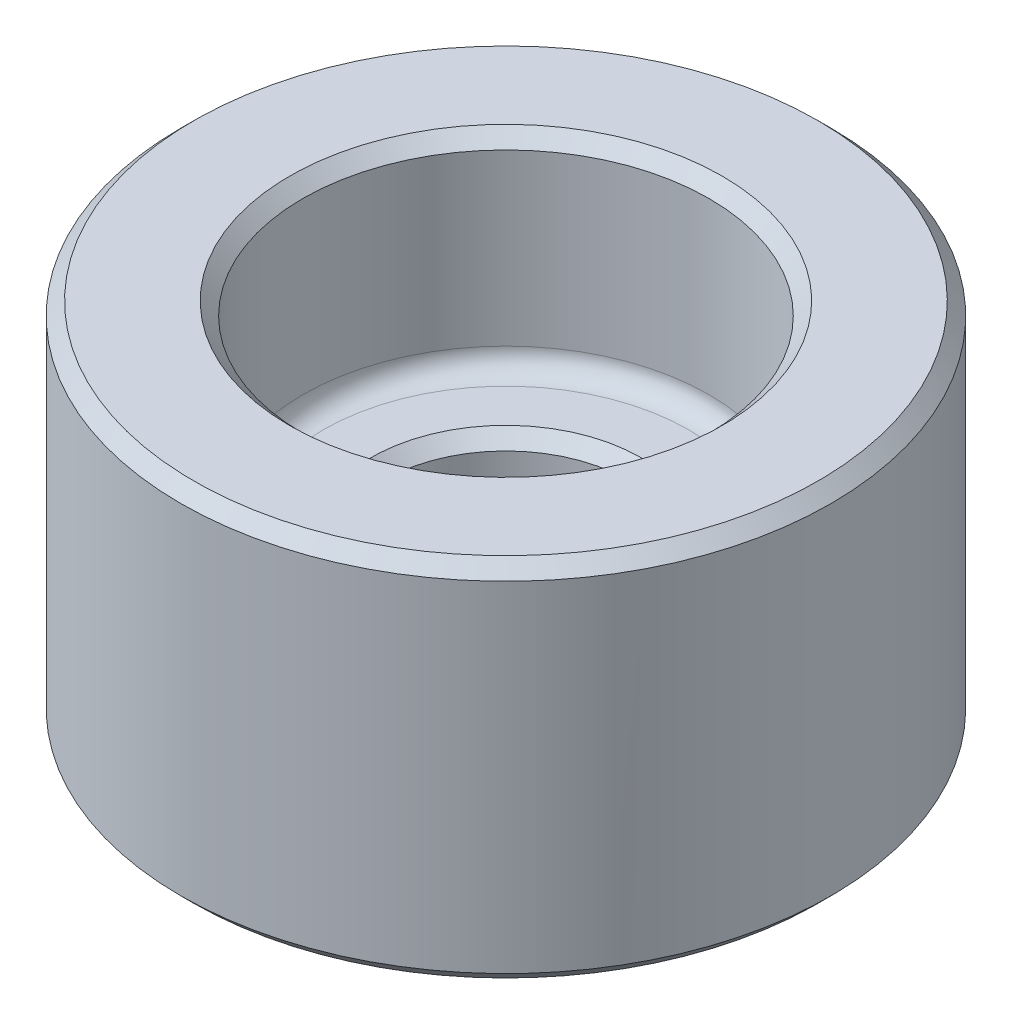
from build123d import *

# Parameters (mm, degrees)
FILLET1_R     = 0.396875
CHAMFER1_SIZE = 0.254


with BuildPart() as part:
    # Sketch1 → Revolve1 (revolve)
    with BuildSketch(Plane.XY, mode=Mode.PRIVATE) as revolve1_sk:
        Polygon((2.38125, 0), (2.38125, 3.175), (3.96875, 3.175), (3.96875, 7.14375), (6.35, 7.14375), (6.35, 0), align=None)
    revolve(revolve1_sk.sketch.rotate(Axis((0, 0, 0), (0, -1, 0)), 90), axis=Axis((0, 0, 0), (0, -1, 0)))

    # Fillet1
    fillet1_edges = [part.edges().sort_by_distance(p)[0] for p in [
        (0, 3.175, -3.96875),
    ]]
    fillet(fillet1_edges, radius=FILLET1_R)

    # Chamfer1
    chamfer1_edges = [part.edges().sort_by_distance(p)[0] for p in [
        (0, 0, -6.35),
        (0, 7.14375, -6.35),
        (0, 7.14375, -3.96875),
        (0, 3.175, -2.38125),
        (0, 0, -2.38125),
    ]]
    chamfer(chamfer1_edges, length=CHAMFER1_SIZE)


solid = part.part
